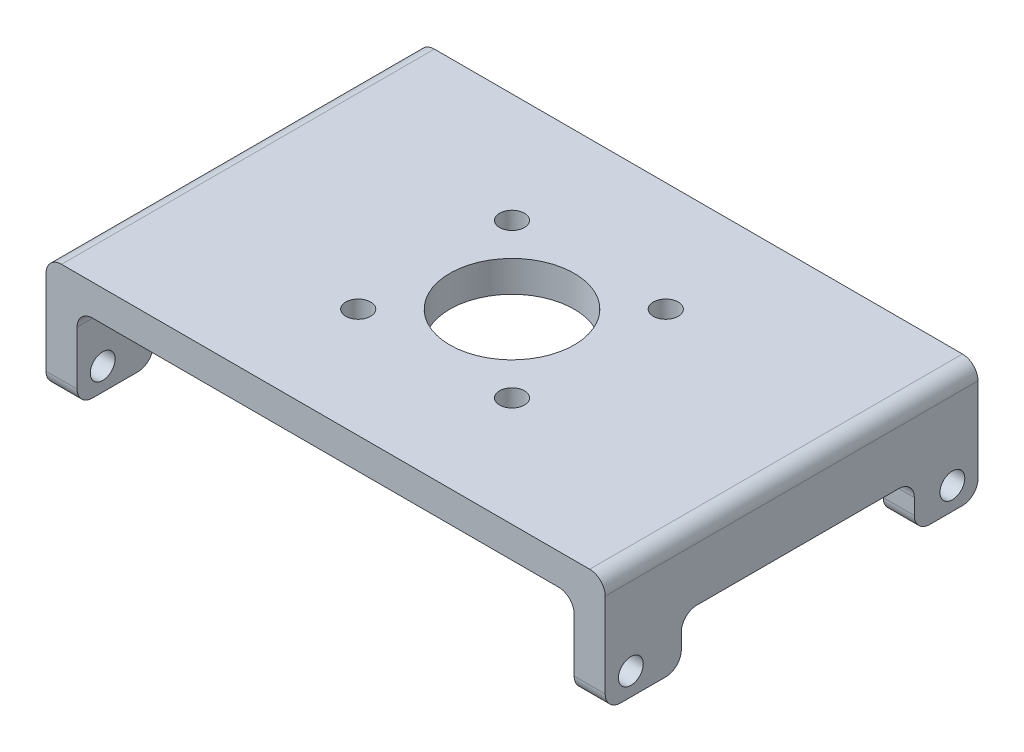
from build123d import *

# Parameters (mm, degrees)
EXTRUDE_1_DEPTH     = 32
FILLET_1_R          = 1
SKETCH_2_R          = 0.8
CUT_EXTRUDE_1_DEPTH = 50.085647116
SKETCH_3_W          = 43.847258393
SKETCH_3_H          = 18.19729806
CUT_EXTRUDE_2_DEPTH = 4
SKETCH_4_W          = 47.825059727
SKETCH_4_H          = 17.237139118
CUT_EXTRUDE_3_DEPTH = 4
SKETCH_5_W          = 40.336284727
SKETCH_5_H          = 27.150302887
CUT_EXTRUDE_4_DEPTH = 2
SKETCH_6_W          = 15
SKETCH_6_H          = 3
CUT_EXTRUDE_5_DEPTH = 47.212335629
FILLET_2_R          = 1
SKETCH_7_R          = 4
SKETCH_7_R_2        = 0.8
CUT_EXTRUDE_6_DEPTH = 2


with BuildPart() as part:
    # 草图1 → 凸台-拉伸1 (new body)
    with BuildSketch(Plane.XY):
        Polygon((-18, 0), (18, 0), (18, -9.455197133), (16, -9.455197133), (16, -2), (-16, -2), (-16, -8.573476703), (-18, -8.573476703), align=None)
    extrude(amount=EXTRUDE_1_DEPTH)

    # 圆角1
    fillet_1_edges = [part.edges().sort_by_distance(p)[0] for p in [
        (-18, 0, 16),
        (18, 0, 16),
        (16, -2, 16),
        (-16, -2, 16),
    ]]
    fillet(fillet_1_edges, radius=FILLET_1_R)

    # 草图2 → 切除-拉伸1 (cut, through all)
    with BuildSketch(Plane(origin=(18, 0, 0), x_dir=(0, 0, -1), z_dir=(1, 0, 0))):
        with Locations((-26.35, -6)):
            Circle(SKETCH_2_R)
        with Locations((-5.65, -6)):
            Circle(SKETCH_2_R)
    extrude(amount=-CUT_EXTRUDE_1_DEPTH, mode=Mode.SUBTRACT)

    # 草图3 → 切除-拉伸2 (cut)
    with BuildSketch(Plane.XY.offset(32)):
        with Locations((-0.045721854, -4.064631677)):
            Rectangle(SKETCH_3_W, SKETCH_3_H)
    extrude(amount=-CUT_EXTRUDE_2_DEPTH, mode=Mode.SUBTRACT)

    # 草图4 → 切除-拉伸3 (cut)
    with BuildSketch(Plane(origin=(0, 0, 0), x_dir=(-1, 0, 0), z_dir=(0, 0, -1))):
        with Locations((0.800132453, -3.310221079)):
            Rectangle(SKETCH_4_W, SKETCH_4_H)
    extrude(amount=-CUT_EXTRUDE_3_DEPTH, mode=Mode.SUBTRACT)

    # 草图5 → 切除-拉伸4 (cut)
    with BuildSketch(Plane.XZ.offset(9.455197133)):
        with Locations((0.686769888, 16.04578466)):
            Rectangle(SKETCH_5_W, SKETCH_5_H)
    extrude(amount=-CUT_EXTRUDE_4_DEPTH, mode=Mode.SUBTRACT)

    # 草图6 → 切除-拉伸5 (cut, through all)
    with BuildSketch(Plane(origin=(18, 0, 0), x_dir=(0, 0, -1), z_dir=(1, 0, 0))):
        with Locations((-15.6, -5.955197133)):
            Rectangle(SKETCH_6_W, SKETCH_6_H)
    extrude(amount=-CUT_EXTRUDE_5_DEPTH, mode=Mode.SUBTRACT)

    # 圆角2
    fillet_2_edges = [part.edges().sort_by_distance(p)[0] for p in [
        (-17, -7.455197133, 4),
        (17, -7.455197133, 4),
        (17, -7.455197133, 28),
        (-17, -7.455197133, 28),
        (17, -7.455197133, 8.1),
        (17, -7.455197133, 23.1),
        (-17, -4.455197133, 23.1),
        (17, -4.455197133, 23.1),
        (-17, -7.455197133, 8.1),
        (-17, -7.455197133, 23.1),
        (-17, -4.455197133, 8.1),
        (17, -4.455197133, 8.1),
    ]]
    fillet(fillet_2_edges, radius=FILLET_2_R)

    # 草图7 → 切除-拉伸6 (cut)
    with BuildSketch(Plane(origin=(0, 0, 0), x_dir=(1, 0, 0), z_dir=(0, 1, 0))):
        with Locations(Location((0, -16, 0), (0, 0, 270))):
            Circle(SKETCH_7_R)
        with Locations(Location((4.949747468, -11.050252532, 0), (0, 0, 270))):
            Circle(SKETCH_7_R_2)
        with Locations(Location((4.949747468, -20.949747468, 0), (0, 0, 270))):
            Circle(SKETCH_7_R_2)
        with Locations(Location((-4.949747468, -20.949747468, 0), (0, 0, 270))):
            Circle(SKETCH_7_R_2)
        with Locations(Location((-4.949747468, -11.050252532, 0), (0, 0, 270))):
            Circle(SKETCH_7_R_2)
    extrude(amount=-CUT_EXTRUDE_6_DEPTH, mode=Mode.SUBTRACT)


solid = part.part
